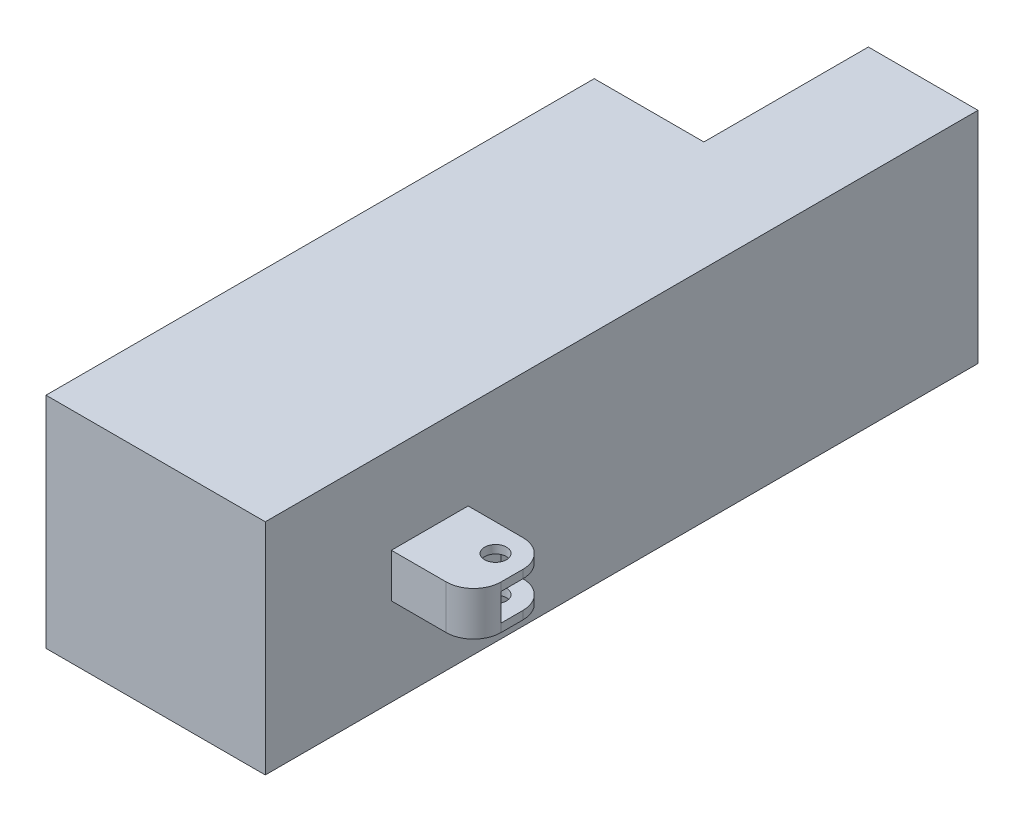
from build123d import *

# Parameters (mm, degrees)
SKETCH1_W           = 200
SKETCH1_H           = 500
BOSS_EXTRUDE1_DEPTH = 200
SKETCH2_W           = 70
SKETCH2_H           = 40
BOSS_EXTRUDE2_DEPTH = 75
FILLET1_R           = 25
SKETCH3_R           = 10
CUT_EXTRUDE1_DEPTH  = 75
SKETCH4_W           = 100
SKETCH4_H           = 200
BOSS_EXTRUDE3_DEPTH = 150
SKETCH6_W           = 45
SKETCH6_H           = 25
CUT_EXTRUDE2_DEPTH  = 45
FILLET2_R           = 15


with BuildPart() as part:
    # Sketch1 → Boss-Extrude1 (new body)
    with BuildSketch(Plane(origin=(0, 0, 0), x_dir=(1, 0, 0), z_dir=(0, 1, 0))):
        with Locations((-100, 250)):
            Rectangle(SKETCH1_W, SKETCH1_H)
    extrude(amount=BOSS_EXTRUDE1_DEPTH)

    # Sketch2 → Boss-Extrude2 (add)
    with BuildSketch(Plane(origin=(0, 0, 0), x_dir=(0, 0, -1), z_dir=(1, 0, 0))):
        with Locations((150, 100)):
            Rectangle(SKETCH2_W, SKETCH2_H)
    extrude(amount=BOSS_EXTRUDE2_DEPTH)

    # Fillet1
    fillet1_edges = [part.edges().sort_by_distance(p)[0] for p in [
        (75, 100, -185),
        (75, 100, -115),
    ]]
    fillet(fillet1_edges, radius=FILLET1_R)

    # Sketch3 → Cut-Extrude1 (cut)
    with BuildSketch(Plane(origin=(0, 120, 0), x_dir=(1, 0, 0), z_dir=(0, 1, 0))):
        with Locations(Location((50, 160, 0), (0, 0, 270))):
            Circle(SKETCH3_R)
    extrude(amount=-CUT_EXTRUDE1_DEPTH, mode=Mode.SUBTRACT)

    # Sketch4 → Boss-Extrude3 (add)
    with BuildSketch(Plane(origin=(0, 0, -500), x_dir=(-1, 0, 0), z_dir=(0, 0, -1))):
        with Locations((50, 100)):
            Rectangle(SKETCH4_W, SKETCH4_H)
    extrude(amount=BOSS_EXTRUDE3_DEPTH)

    # Sketch6 → Cut-Extrude2 (cut)
    with BuildSketch(Plane(origin=(75, 0, 0), x_dir=(0, 0, -1), z_dir=(1, 0, 0))):
        with Locations((162.5, 100)):
            Rectangle(SKETCH6_W, SKETCH6_H)
    extrude(amount=-CUT_EXTRUDE2_DEPTH, mode=Mode.SUBTRACT)

    # Fillet2
    fillet2_edges = [part.edges().sort_by_distance(p)[0] for p in [
        (30, 100, -140),
    ]]
    fillet(fillet2_edges, radius=FILLET2_R)


solid = part.part
